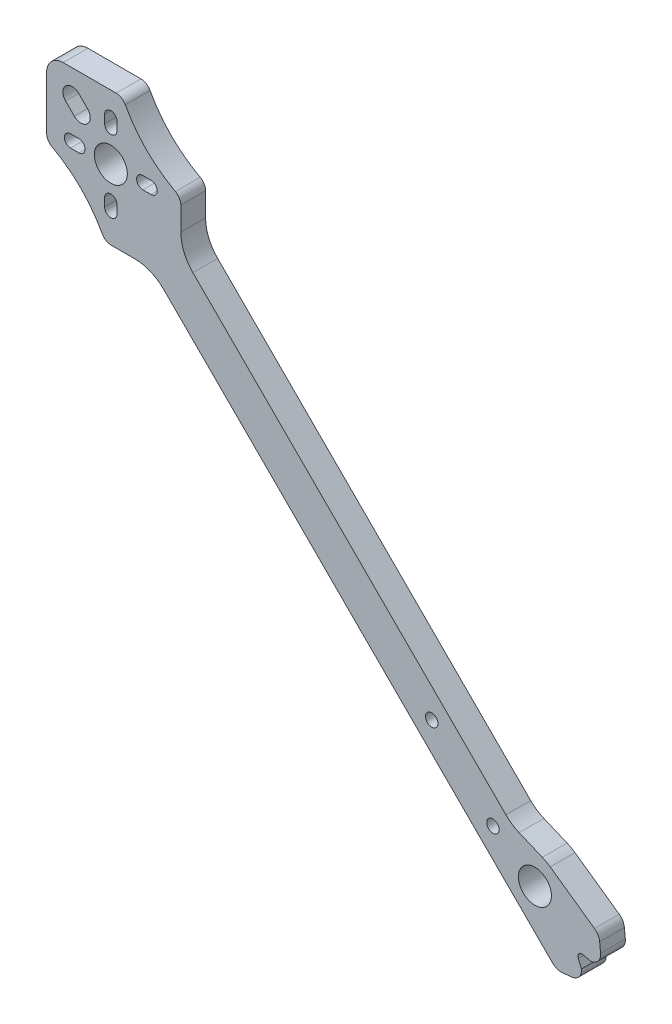
from build123d import *

# Parameters (mm, degrees)
CROQUIS1_R              = 1.5
CROQUIS1_R_2            = 4
SALIENTE_EXTRUIR1_DEPTH = 6
CROQUIS4_R              = 4
SALIENTE_EXTRUIR3_DEPTH = 6
CORTAR_EXTRUIR1_DEPTH   = 6
REDONDEO3_R             = 4
CORTAR_EXTRUIR2_DEPTH   = 6
REDONDEO4_R             = 2.5
REDONDEO6_R             = 10
CORTAR_EXTRUIR3_START   = -6
CROQUIS9_R              = 4
CORTAR_EXTRUIR3_DEPTH   = 6
CROQUIS15_R             = 4
SALIENTE_EXTRUIR4_DEPTH = 6
REDONDEO12_R            = 10
REDONDEO13_R            = 3


with BuildPart() as part:
    # Croquis1 → Saliente-Extruir1 (new body)
    with BuildSketch(Plane.XY):
        with BuildLine():
            Line((-17.112213819, 2.294275414), (-30.516043414, 23.123582692))
            ThreePointArc((-30.516043414, 23.123582692), (-31.14080226, 23.989156666), (-31.854269143, 24.783201331))
            Line((-31.854269143, 24.783201331), (-45.961940777, 38.890872965))
            Line((-45.961940777, 38.890872965), (-106.773123959, 99.702056147))
            Line((-106.773123959, 99.702056147), (-99.702056147, 106.773123959))
            Line((-99.702056147, 106.773123959), (-38.890872965, 45.961940777))
            Line((-38.890872965, 45.961940777), (-24.783201331, 31.854269143))
            ThreePointArc((-24.783201331, 31.854269143), (-23.989156666, 31.14080226), (-23.123582692, 30.516043414))
            Line((-23.123582692, 30.516043414), (-2.294275414, 17.112213819))
            ThreePointArc((-2.294275414, 17.112213819), (-0.610887166, 15.302496804), (0, 12.907567049))
            Line((0, 12.907567049), (0, 7.055686841))
            ThreePointArc((0, 7.055686841), (-0.823113423, 5.438609853), (-2.614937985, 5.15257064))
            Line((-2.614937985, 5.15257064), (-4.503911831, 5.762938925))
            ThreePointArc((-4.503911831, 5.762938925), (-5.518487605, 5.518487605), (-5.762938925, 4.503911831))
            Line((-5.762938925, 4.503911831), (-5.15257064, 2.614937985))
            ThreePointArc((-5.15257064, 2.614937985), (-5.438609853, 0.823113423), (-7.055686841, 0))
            Line((-7.055686841, 0), (-12.907567049, 0))
            ThreePointArc((-12.907567049, 0), (-15.302496804, 0.610887166), (-17.112213819, 2.294275414))
        make_face()
        with Locations((-38.890872965, 38.890872965)):
            Circle(CROQUIS1_R, mode=Mode.SUBTRACT)
        with Locations((-24.04163056, 24.04163056)):
            Circle(CROQUIS1_R, mode=Mode.SUBTRACT)
        with Locations((-15.25, 15.25)):
            Circle(CROQUIS1_R_2, mode=Mode.SUBTRACT)
    extrude(amount=SALIENTE_EXTRUIR1_DEPTH)

    # Croquis4 → Saliente-Extruir3 (add)
    with BuildSketch(Plane.XY.offset(6)):
        Polygon((-106.773123959, 99.702056147), (-118.086832458, 99.702056147), (-132.228968082, 113.844191771), (-132.228968082, 132.228968082), (-113.844191771, 132.228968082), (-99.702056147, 118.086832458), (-99.702056147, 106.773123959), align=None)
        with Locations((-116.672618896, 116.672618896)):
            Circle(CROQUIS4_R, mode=Mode.SUBTRACT)
    extrude(amount=-SALIENTE_EXTRUIR3_DEPTH)

    # Croquis5 → Cortar-Extruir1 (cut)
    with BuildSketch(Plane.XY.offset(6)):
        with BuildLine():
            Line((-127.632774004, 124.450793489), (-125.511453661, 122.329473145))
            ThreePointArc((-125.511453661, 122.329473145), (-122.329473145, 122.329473145), (-122.329473145, 125.511453661))
            Line((-122.329473145, 125.511453661), (-124.450793489, 127.632774004))
            ThreePointArc((-124.450793489, 127.632774004), (-127.632774004, 127.632774004), (-127.632774004, 124.450793489))
        make_face()
        with BuildLine():
            Line((-118.172618896, 108.922618896), (-118.172618896, 106.922618896))
            ThreePointArc((-118.172618896, 106.922618896), (-116.672618896, 105.422618896), (-115.172618896, 106.922618896))
            Line((-115.172618896, 106.922618896), (-115.172618896, 108.922618896))
            ThreePointArc((-115.172618896, 108.922618896), (-116.672618896, 110.422618896), (-118.172618896, 108.922618896))
        make_face()
        with BuildLine():
            Line((-108.922618896, 115.172618896), (-106.922618896, 115.172618896))
            ThreePointArc((-106.922618896, 115.172618896), (-105.422618896, 116.672618896), (-106.922618896, 118.172618896))
            Line((-106.922618896, 118.172618896), (-108.922618896, 118.172618896))
            ThreePointArc((-108.922618896, 118.172618896), (-110.422618896, 116.672618896), (-108.922618896, 115.172618896))
        make_face()
        with BuildLine():
            Line((-124.422618896, 118.172618896), (-126.422618896, 118.172618896))
            ThreePointArc((-126.422618896, 118.172618896), (-127.922618896, 116.672618896), (-126.422618896, 115.172618896))
            Line((-126.422618896, 115.172618896), (-124.422618896, 115.172618896))
            ThreePointArc((-124.422618896, 115.172618896), (-122.922618896, 116.672618896), (-124.422618896, 118.172618896))
        make_face()
        with BuildLine():
            Line((-115.172618896, 124.422618896), (-115.172618896, 126.422618896))
            ThreePointArc((-115.172618896, 126.422618896), (-116.672618896, 127.922618896), (-118.172618896, 126.422618896))
            Line((-118.172618896, 126.422618896), (-118.172618896, 124.422618896))
            ThreePointArc((-118.172618896, 124.422618896), (-116.672618896, 122.922618896), (-115.172618896, 124.422618896))
        make_face()
    extrude(amount=-CORTAR_EXTRUIR1_DEPTH, mode=Mode.SUBTRACT)

    # Redondeo3
    redondeo3_edges = [part.edges().sort_by_distance(p)[0] for p in [
        (-132.228968082, 132.228968082, 3),
    ]]
    fillet(redondeo3_edges, radius=REDONDEO3_R)

    # Croquis7 → Cortar-Extruir2 (cut)
    with BuildSketch(Plane.XY.offset(6)):
        with BuildLine():
            Line((-132.228968082, 113.844191771), (-118.086832458, 99.702056147))
            ThreePointArc((-118.086832458, 99.702056147), (-123.944696834, 107.986327395), (-132.228968082, 113.844191771))
        make_face()
        with BuildLine():
            Line((-113.844191771, 132.228968082), (-99.702056147, 118.086832458))
            ThreePointArc((-99.702056147, 118.086832458), (-107.986327395, 123.944696834), (-113.844191771, 132.228968082))
        make_face()
    extrude(amount=-CORTAR_EXTRUIR2_DEPTH, mode=Mode.SUBTRACT)

    # Redondeo4
    redondeo4_edges = [part.edges().sort_by_distance(p)[0] for p in [
        (-118.086832458, 99.702056147, 3),
        (-132.228968082, 113.844191771, 3),
        (-113.844191771, 132.228968082, 3),
        (-99.702056147, 118.086832458, 3),
    ]]
    fillet(redondeo4_edges, radius=REDONDEO4_R)

    # Redondeo6
    redondeo6_edges = [part.edges().sort_by_distance(p)[0] for p in [
        (-106.773123959, 99.702056147, 3),
        (-99.702056147, 106.773123959, 3),
    ]]
    fillet(redondeo6_edges, radius=REDONDEO6_R)

    # Croquis9 → Cortar-Extruir3 (cut)
    with BuildSketch(Plane.XY.offset(6).offset(CORTAR_EXTRUIR3_START)):
        with BuildLine():
            Line((-23.047623594, 15.976555782), (-31.854269143, 24.783201331))
            ThreePointArc((-31.854269143, 24.783201331), (-31.14080226, 23.989156666), (-30.516043414, 23.123582692))
            Line((-30.516043414, 23.123582692), (-17.112213819, 2.294275414))
            ThreePointArc((-17.112213819, 2.294275414), (-15.302496804, 0.610887166), (-12.907567049, 0))
            Line((-12.907567049, 0), (-7.055686841, 0))
            ThreePointArc((-7.055686841, 0), (-5.438609853, 0.823113423), (-5.15257064, 2.614937985))
            Line((-5.15257064, 2.614937985), (-5.762938925, 4.503911831))
            ThreePointArc((-5.762938925, 4.503911831), (-5.518487605, 5.518487605), (-4.503911831, 5.762938925))
            Line((-4.503911831, 5.762938925), (-2.614937985, 5.15257064))
            ThreePointArc((-2.614937985, 5.15257064), (-0.823113423, 5.438609853), (0, 7.055686841))
            Line((0, 7.055686841), (0, 12.907567049))
            ThreePointArc((0, 12.907567049), (-0.610887166, 15.302496804), (-2.294275414, 17.112213819))
            Line((-2.294275414, 17.112213819), (-23.123582692, 30.516043414))
            ThreePointArc((-23.123582692, 30.516043414), (-23.989156666, 31.14080226), (-24.783201331, 31.854269143))
            Line((-24.783201331, 31.854269143), (-15.976555782, 23.047623594))
            Line((-15.976555782, 23.047623594), (-23.047623594, 15.976555782))
        make_face()
        with Locations((-15.25, 15.25)):
            Circle(CROQUIS9_R, mode=Mode.SUBTRACT)
    extrude(amount=CORTAR_EXTRUIR3_DEPTH, mode=Mode.SUBTRACT)

    # Croquis15 → Saliente-Extruir4 (add)
    with BuildSketch(Plane.XY.offset(6)):
        with BuildLine():
            Line((-19.512089688, 26.5831575), (-15.976555782, 23.047623594))
            Line((-15.976555782, 23.047623594), (-23.047623594, 15.976555782))
            Line((-23.047623594, 15.976555782), (-8.609865422, 1.53879761))
            Line((-8.609865422, 1.53879761), (-4.93762751, 1.898269736))
            ThreePointArc((-4.93762751, 1.898269736), (-3.171999371, 2.840663892), (-2.589885038, 4.755524821))
            Line((-2.589885038, 4.755524821), (-3.381380182, 6.576048667))
            ThreePointArc((-3.381380182, 6.576048667), (-3.236935195, 7.609613418), (-2.251001031, 7.95174537))
            Line((-2.251001031, 7.95174537), (-0.311548805, 7.528310963))
            ThreePointArc((-0.311548805, 7.528310963), (1.454079334, 8.470705119), (2.036193666, 10.385566048))
            Line((2.036193666, 10.385566048), (1.676721541, 14.05780396))
            Line((1.676721541, 14.05780396), (-11.059892894, 23.047623594))
            Line((-11.059892894, 23.047623594), (-19.512089688, 26.5831575))
        make_face()
        with Locations((-13.881053208, 16.502885084)):
            Circle(CROQUIS15_R, mode=Mode.SUBTRACT)
    extrude(amount=-SALIENTE_EXTRUIR4_DEPTH)

    # Redondeo12
    redondeo12_edges = [part.edges().sort_by_distance(p)[0] for p in [
        (-19.512089688, 26.5831575, 3),
        (-11.059892894, 23.047623594, 3),
    ]]
    fillet(redondeo12_edges, radius=REDONDEO12_R)

    # Redondeo13
    redondeo13_edges = [part.edges().sort_by_distance(p)[0] for p in [
        (-8.609865422, 1.53879761, 3),
        (1.676721541, 14.05780396, 3),
    ]]
    fillet(redondeo13_edges, radius=REDONDEO13_R)


solid = part.part
